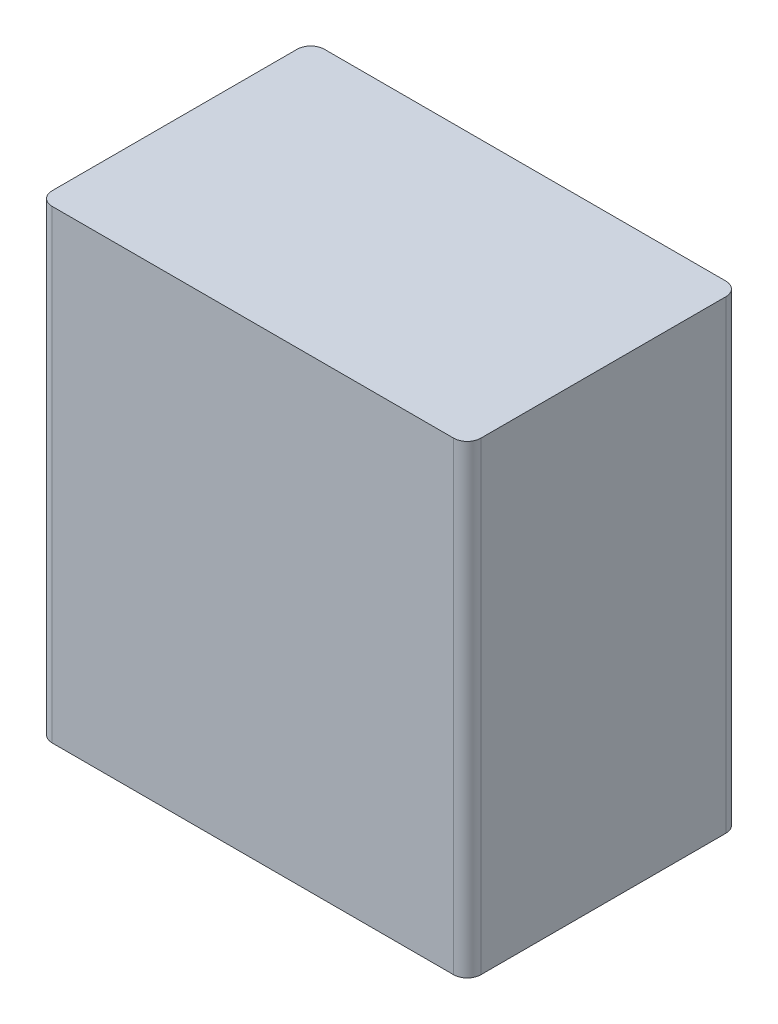
from build123d import *

# Parameters (mm, degrees)
SKETCH_1_W         = 63
SKETCH_1_H         = 68.3
BLOCKEXTRUDE_DEPTH = 40
FILLET_2_R         = 2


with BuildPart() as part:
    # 草图1 → BlockExtrude (new body)
    with BuildSketch(Plane.XY):
        with Locations((31.5, 34.15)):
            Rectangle(SKETCH_1_W, SKETCH_1_H)
    extrude(amount=BLOCKEXTRUDE_DEPTH)

    # Fillet 2
    fillet_2_edges = [part.edges().sort_by_distance(p)[0] for p in [
        (63, 34.15, 40),
        (0, 34.15, 40),
        (63, 34.15, 0),
        (0, 34.15, 0),
    ]]
    fillet(fillet_2_edges, radius=FILLET_2_R)


solid = part.part
